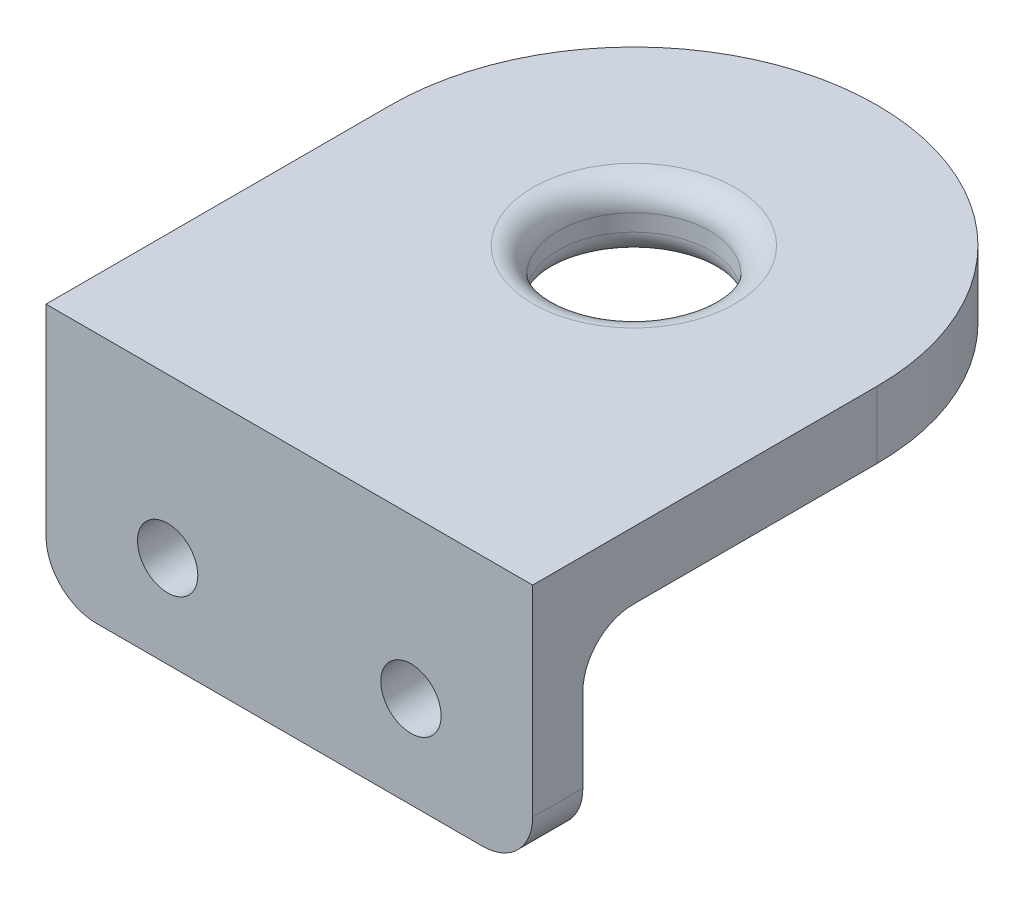
from build123d import *

# Parameters (mm, degrees)
SKETCH1_R           = 4.525
BOSS_EXTRUDE1_DEPTH = 4
SKETCH2_W           = 29.05
SKETCH2_H           = 15
BOSS_EXTRUDE2_DEPTH = 3
SKETCH3_R           = 1.8
CUT_EXTRUDE1_DEPTH  = 37.906160055
FILLET1_R           = 3
FILLET2_R           = 1.5


with BuildPart() as part:
    # Sketch1 → Boss-Extrude1 (new body)
    with BuildSketch(Plane(origin=(0, 0, 0), x_dir=(1, 0, 0), z_dir=(0, 1, 0))):
        with BuildLine():
            Line((-14.525, 20.57), (-14.525, 0))
            Line((-14.525, 0), (14.525, 0))
            Line((14.525, 0), (14.525, 20.57))
            ThreePointArc((14.525, 20.57), (0, 35.095), (-14.525, 20.57))
        make_face()
        with Locations(Location((0, 20.57, 0), (0, 0, 270))):
            Circle(SKETCH1_R, mode=Mode.SUBTRACT)
    extrude(amount=BOSS_EXTRUDE1_DEPTH)

    # Sketch2 → Boss-Extrude2 (add)
    with BuildSketch(Plane.XY):
        with Locations((0, -3.5)):
            Rectangle(SKETCH2_W, SKETCH2_H)
    extrude(amount=-BOSS_EXTRUDE2_DEPTH)

    # Sketch3 → Cut-Extrude1 (cut, through all)
    with BuildSketch(Plane(origin=(0, 0, -3), x_dir=(-1, 0, 0), z_dir=(0, 0, -1))):
        with Locations((-7.2625, -5.5)):
            Circle(SKETCH3_R)
        with Locations(Location((7.2625, -5.5, 0), (0, 0, 180))):
            Circle(SKETCH3_R)
    extrude(amount=-CUT_EXTRUDE1_DEPTH, mode=Mode.SUBTRACT)

    # Fillet1
    fillet1_edges = [part.edges().sort_by_distance(p)[0] for p in [
        (-14.525, -11, -1.5),
        (0, 0, -3),
        (14.525, -11, -1.5),
    ]]
    fillet(fillet1_edges, radius=FILLET1_R)

    # Fillet2
    fillet2_edges = [part.edges().sort_by_distance(p)[0] for p in [
        (0, 0, -25.095),
        (0, 4, -25.095),
    ]]
    fillet(fillet2_edges, radius=FILLET2_R)


solid = part.part
